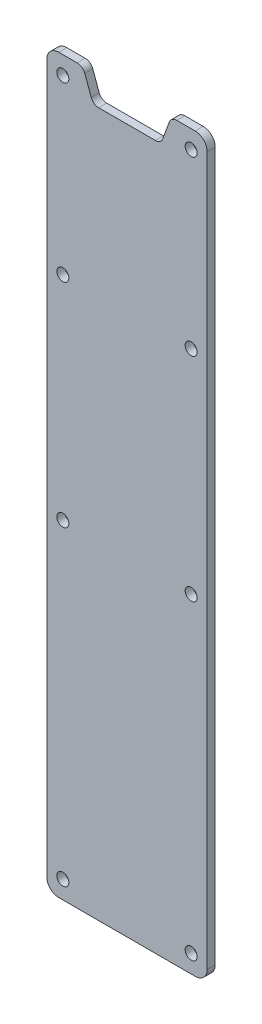
from build123d import *

# Parameters (mm, degrees)
CROQUIS1_R                 = 1.5
SALIENTE_EXTRUIR1_DEPTH    = 2
CORTAR_EXTRUIR1_DEPTH      = 96.880459427
CORTAR_EXTRUIR1_DEPTH_BACK = 2


with BuildPart() as part:
    # Croquis1 → Saliente-Extruir1 (new body)
    with BuildSketch(Plane.XY):
        with BuildLine():
            Line((-17, 88.75), (17, 88.75))
            ThreePointArc((17, 88.75), (19.121320344, 87.871320344), (20, 85.75))
            Line((20, 85.75), (20, -90.75))
            ThreePointArc((20, -90.75), (19.121320344, -92.871320344), (17, -93.75))
            Line((17, -93.75), (-17, -93.75))
            ThreePointArc((-17, -93.75), (-19.121320344, -92.871320344), (-20, -90.75))
            Line((-20, -90.75), (-20, 85.75))
            ThreePointArc((-20, 85.75), (-19.121320344, 87.871320344), (-17, 88.75))
        make_face()
        with Locations((-16, 84.25)):
            Circle(CROQUIS1_R, mode=Mode.SUBTRACT)
        with Locations((16, 84.25)):
            Circle(CROQUIS1_R, mode=Mode.SUBTRACT)
        with Locations((-16, 41.25)):
            Circle(CROQUIS1_R, mode=Mode.SUBTRACT)
        with Locations((16, 41.25)):
            Circle(CROQUIS1_R, mode=Mode.SUBTRACT)
        with Locations((-16, -11.75)):
            Circle(CROQUIS1_R, mode=Mode.SUBTRACT)
        with Locations((16, -11.75)):
            Circle(CROQUIS1_R, mode=Mode.SUBTRACT)
        with Locations((-16, -89.25)):
            Circle(CROQUIS1_R, mode=Mode.SUBTRACT)
        with Locations((16, -89.25)):
            Circle(CROQUIS1_R, mode=Mode.SUBTRACT)
    extrude(amount=SALIENTE_EXTRUIR1_DEPTH)

    # Croquis2 → Cortar-Extruir1 (cut, two sides: drawn at the far end of the back side and taken through both)
    with BuildSketch(Plane.XY.offset(2).offset(-CORTAR_EXTRUIR1_DEPTH_BACK)):
        with BuildLine():
            ThreePointArc((-12.400415076, 88.75), (-11.253262204, 88.388304089), (-10.521029835, 87.434040287))
            Line((-10.521029835, 87.434040287), (-8.931178525, 83.065959713))
            ThreePointArc((-8.931178525, 83.065959713), (-8.198946156, 82.111695911), (-7.051793284, 81.75))
            Line((-7.051793284, 81.75), (7.051793284, 81.75))
            ThreePointArc((7.051793284, 81.75), (8.198946156, 82.111695911), (8.931178525, 83.065959713))
            Line((8.931178525, 83.065959713), (10.521029835, 87.434040287))
            ThreePointArc((10.521029835, 87.434040287), (11.253262204, 88.388304089), (12.400415076, 88.75))
            Line((12.400415076, 88.75), (-12.400415076, 88.75))
        make_face()
    extrude(amount=CORTAR_EXTRUIR1_DEPTH + CORTAR_EXTRUIR1_DEPTH_BACK, mode=Mode.SUBTRACT)


solid = part.part
